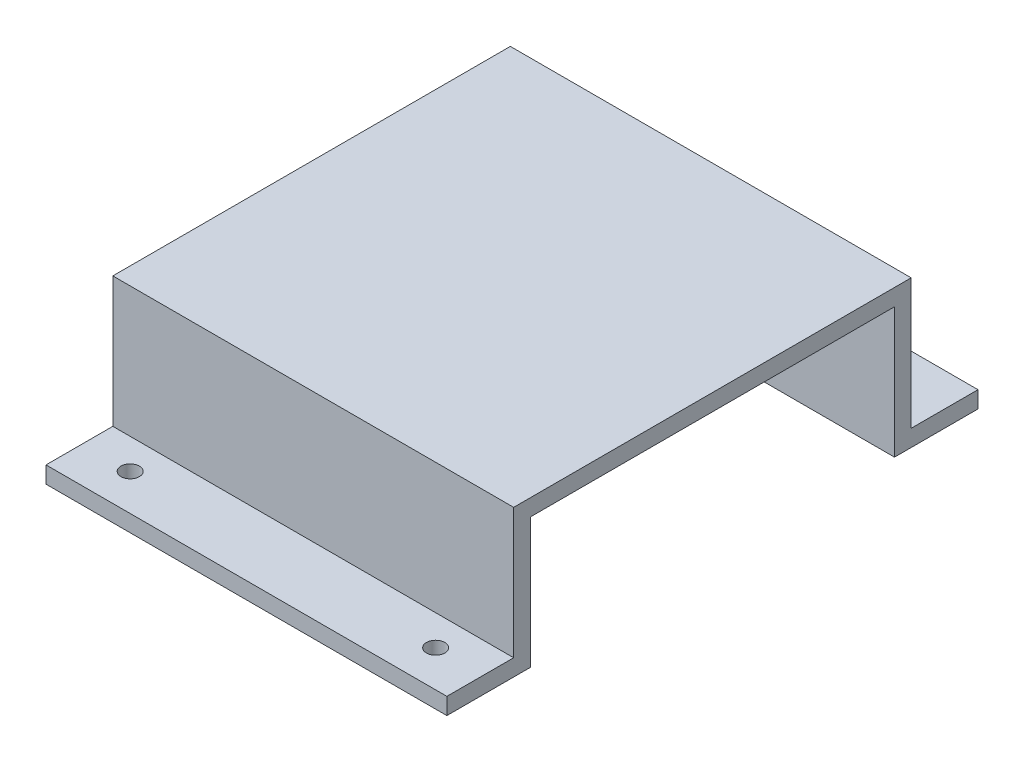
from build123d import *

# Parameters (mm, degrees)
BOSS_EXTRUDE1_DEPTH = 60
SKETCH2_R           = 2.75
CUT_EXTRUDE1_DEPTH  = 107.963778916


with BuildPart() as part:
    # Sketch1 → Boss-Extrude1 (new, symmetric)
    with BuildSketch(Plane.YZ):
        Polygon((39, 0), (39, 54.5), (0, 54.5), (0, 79.5), (5, 79.5), (5, 59.5), (44, 59.5), (44, 0), (44, -59.5), (5, -59.5), (5, -79.5), (0, -79.5), (0, -54.5), (39, -54.5), align=None)
    extrude(amount=BOSS_EXTRUDE1_DEPTH, both=True)

    # Sketch2 → Cut-Extrude1 (cut, through all)
    with BuildSketch(Plane(origin=(0, 5, 0), x_dir=(-1, 0, 0), z_dir=(0, 1, 0))):
        with Locations(Location((-45.72, 68.58, 0), (0, 0, 90))):
            Circle(SKETCH2_R)
        with Locations(Location((45.72, 68.58, 0), (0, 0, 90))):
            Circle(SKETCH2_R)
        with Locations(Location((45.72, -68.58, 0), (0, 0, 90))):
            Circle(SKETCH2_R)
        with Locations(Location((-45.72, -68.58, 0), (0, 0, 90))):
            Circle(SKETCH2_R)
    extrude(amount=-CUT_EXTRUDE1_DEPTH, mode=Mode.SUBTRACT)


solid = part.part
